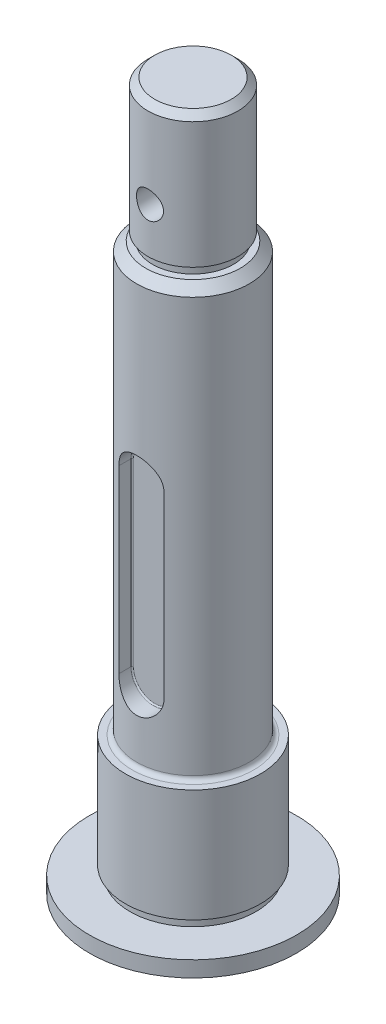
from build123d import *

# Parameters (mm, degrees)
CUT_EXTRUDE_1_DEPTH = 4
FILLET_1_R          = 0.3
SKETCH_3_R          = 3
CUT_EXTRUDE_2_DEPTH = 25


with BuildPart() as part:
    # Эскиз1 → Повернуть1 (revolve)
    with BuildSketch(Plane.XY, mode=Mode.PRIVATE) as revolve_1_sk:
        with BuildLine():
            Line((0, 157), (0, 0))
            Line((0, 0), (23, 0))
            Line((23, 0), (23, 3.5))
            Line((23, 3.5), (14, 3.5))
            Line((14, 3.5), (14, 5.5))
            Line((14, 5.5), (15, 5.5))
            Line((15, 5.5), (15, 30.5))
            Line((15, 30.5), (13.5, 30.5))
            ThreePointArc((13.5, 30.5), (12.792893219, 30.792893219), (12.5, 31.5))
            Line((12.5, 31.5), (12.5, 123.5))
            Line((12.5, 123.5), (10.5, 125.5))
            Line((10.5, 125.5), (9, 125.5))
            Line((9, 125.5), (9, 127.5))
            Line((9, 127.5), (10, 127.5))
            Line((10, 127.5), (10, 155.5))
            Line((10, 155.5), (8.5, 157))
            Line((8.5, 157), (0, 157))
        make_face()
    revolve(revolve_1_sk.sketch.rotate(Axis((0, 157, 0), (0, -1, 0)), 180), axis=Axis((0, 157, 0), (0, -1, 0)))

    # Эскиз2 → Вырез-Вытянуть1 (cut)
    with BuildSketch(Plane.XY.offset(12.5)):
        with BuildLine():
            Line((5, 45.5), (5, 85.5))
            ThreePointArc((5, 85.5), (0, 90.5), (-5, 85.5))
            Line((-5, 85.5), (-5, 45.5))
            ThreePointArc((-5, 45.5), (0, 40.5), (5, 45.5))
        make_face()
    extrude(amount=-CUT_EXTRUDE_1_DEPTH, mode=Mode.SUBTRACT)

    # Скругление1
    fillet_1_edges = [part.edges().sort_by_distance(p)[0] for p in [
        (0, 40.5, 8.5),
        (-5, 65.5, 8.5),
        (0, 90.5, 8.5),
        (5, 65.5, 8.5),
    ]]
    fillet(fillet_1_edges, radius=FILLET_1_R)

    # Эскиз3 → Вырез-Вытянуть2 (cut)
    with BuildSketch(Plane.XY.offset(10)):
        with Locations((0, 137.5)):
            Circle(SKETCH_3_R)
    extrude(amount=-CUT_EXTRUDE_2_DEPTH, mode=Mode.SUBTRACT)


solid = part.part
